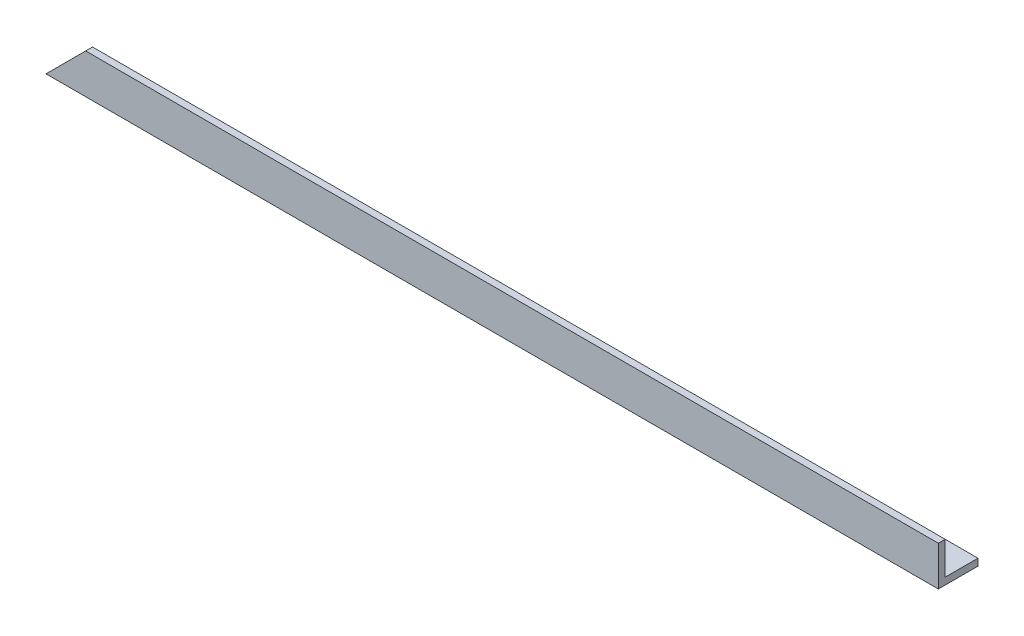
from build123d import *

# Parameters (mm, degrees)
BOSS_EXTRUDE1_DEPTH = 450
CUT_EXTRUDE1_DEPTH  = 451.888012704


with BuildPart() as part:
    # Sketch1 → Boss-Extrude1 (new body)
    with BuildSketch(Plane(origin=(0, 0, 0), x_dir=(0, 0, -1), z_dir=(1, 0, 0))):
        Polygon((0, 0), (20, 0), (20, 3.461178467), (3.461178467, 3.461178467), (3.461178467, 20), (0, 20), align=None)
    extrude(amount=BOSS_EXTRUDE1_DEPTH)

    # Sketch2 → Cut-Extrude1 (cut, through all)
    with BuildSketch(Plane(origin=(0, 0, 0), x_dir=(1, 0, 0), z_dir=(0, 0, -1))):
        Polygon((0, -20), (0, 0), (20, -20), align=None)
    extrude(amount=CUT_EXTRUDE1_DEPTH, mode=Mode.SUBTRACT)


solid = part.part
